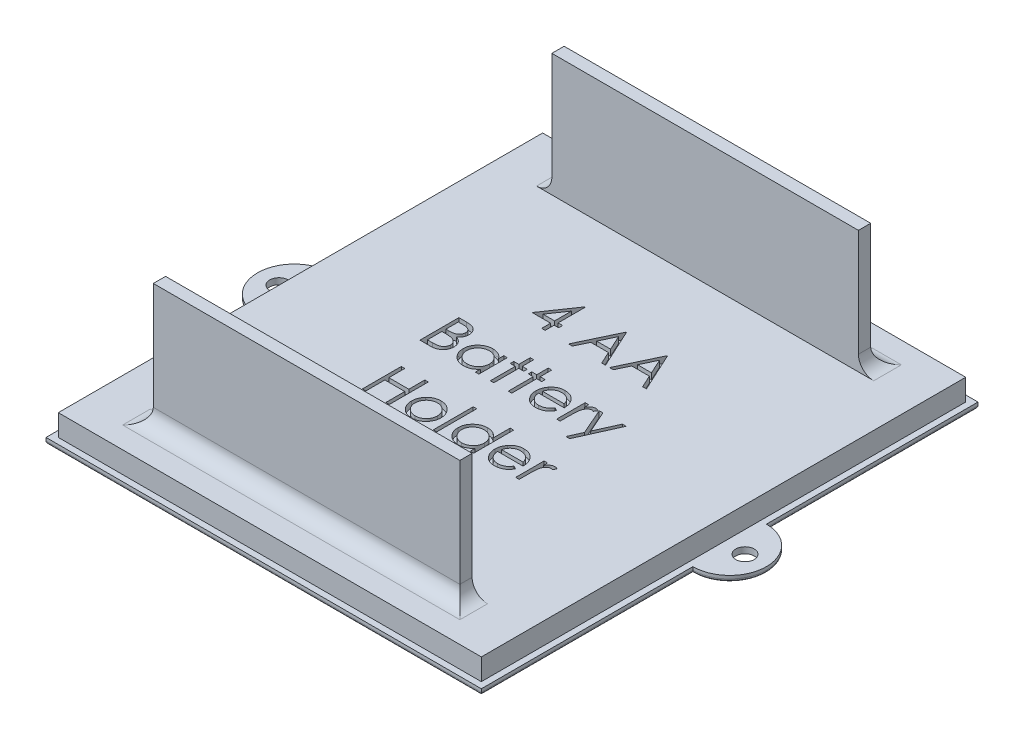
from build123d import *

# Parameters (mm, degrees)
SKETCH1_W            = 71
SKETCH1_H            = 81
BOSS_EXTRUDE1_DEPTH  = 4.5
TEXT_2_W             = 0.569871795
TEXT_2_H             = 6.512820513
CUT_EXTRUDE1_DEPTH   = 1
BOSS_EXTRUDE3_DEPTH  = 4.5
SKETCH5_R            = 1.5
CUT_EXTRUDE2_DEPTH   = 4.5
SKETCH9_W            = 50
SKETCH9_H            = 2
TOP_TRACK_DEPTH      = 20
SKETCH51_W           = 89
SKETCH51_H           = 99
SKETCH51_W_2         = 69
SKETCH51_H_2         = 79
CUT_EXTRUDE25_DEPTH  = 3.5
FILLET2_R            = 0.5
FILLET3_R            = 2.5
FILLET3_OF_MIRROR4_R = 2.5


with BuildPart() as part:
    # Sketch1 → Boss-Extrude1 (new body)
    with BuildSketch(Plane(origin=(0, 0, 0), x_dir=(1, 0, 0), z_dir=(0, 1, 0))):
        Rectangle(SKETCH1_W, SKETCH1_H)
    extrude(amount=BOSS_EXTRUDE1_DEPTH)

    # text 2 → Cut-Extrude1 (cut)
    # profile 1 of 16: a face of its own
    with BuildSketch(Plane(origin=(0, 4.5, 0), x_dir=(1, 0, 0), z_dir=(0, 1, 0))):
        Polygon((-6.532893084, 18.330539216), (-6.417137876, 18.330539216), (-6.417137876, 13.934385369), (-5.684445568, 13.934385369), (-5.684445568, 13.283103318), (-6.417137876, 13.283103318), (-6.417137876, 11.817718703), (-6.987009671, 11.817718703), (-6.987009671, 13.283103318), (-9.999189158, 13.283103318), align=None)
        Polygon((-6.987009671, 13.934385369), (-6.987009671, 16.692157805), (-8.879798132, 13.934385369), align=None, mode=Mode.SUBTRACT)
    # profile 2 of 16: a face of its own
    with BuildSketch(Plane(origin=(0, 4.5, 0), x_dir=(1, 0, 0), z_dir=(0, 1, 0))):
        Polygon((0.502733919, 18.167718703), (3.43350315, 11.817718703), (2.81402198, 11.817718703), (1.875259961, 13.852975113), (-1.003355825, 13.852975113), (-1.968830584, 11.817718703), (-2.590855825, 11.817718703), (0.421323663, 18.167718703), align=None)
        Polygon((0.455668615, 16.930028398), (-0.694251257, 14.504257164), (1.57505964, 14.504257164), align=None, mode=Mode.SUBTRACT)
    # profile 3 of 16: a face of its own
    with BuildSketch(Plane(origin=(0, 4.5, 0), x_dir=(1, 0, 0), z_dir=(0, 1, 0))):
        Polygon((7.178374945, 18.167718703), (10.109144175, 11.817718703), (9.489663006, 11.817718703), (8.550900986, 13.852975113), (5.672285201, 13.852975113), (4.706810441, 11.817718703), (4.084785201, 11.817718703), (7.096964688, 18.167718703), align=None)
        Polygon((7.13130964, 16.930028398), (5.981389768, 14.504257164), (8.250700666, 14.504257164), align=None, mode=Mode.SUBTRACT)
    # profile 4 of 16: a face of its own
    with BuildSketch(Plane(origin=(0, 4.5, 0), x_dir=(1, 0, 0), z_dir=(0, 1, 0))):
        with BuildLine():
            Line((-15.250150696, 6.584385369), (-14.011188357, 6.584385369))
            add(Edge.make_bspline(
                [(-14.011188357, 6.584385369), (-13.950539546, 6.584066508), (-13.832987057, 6.583448475), (-13.66204607, 6.573863366), (-13.501937514, 6.56079385), (-13.352614955, 6.540056397), (-13.214147395, 6.515034172), (-13.086117539, 6.484732306), (-12.968932512, 6.448398307), (-12.829027976, 6.390620054), (-12.669514777, 6.304762306), (-12.496797693, 6.177891909), (-12.349107145, 6.022711583), (-12.221769112, 5.847664479), (-12.120529938, 5.655103865), (-12.047288498, 5.449619337), (-12.00091921, 5.233861319), (-11.99615048, 5.085737268), (-11.99374044, 5.010877757)],
                knots=[0, 0, 0, 0, 1.001505555, 1.941167018, 2.826882275, 3.653841531, 4.429895133, 5.150066043, 5.825578002, 6.45369114, 7.647487171, 8.808567382, 9.977351308, 11.170798116, 12.373658725, 13.556498008, 14.765093433, 16, 16, 16, 16], degree=3))
            add(Edge.make_bspline(
                [(-11.99374044, 5.010877757), (-11.995723851, 4.940750978), (-11.999621439, 4.802945242), (-12.036891874, 4.601388787), (-12.095240516, 4.409525861), (-12.17634861, 4.228056676), (-12.281762232, 4.061081407), (-12.406690896, 3.907253081), (-12.557415952, 3.773084735), (-12.670342973, 3.698076898), (-12.727704783, 3.659976315)],
                knots=[0, 0, 0, 0, 1.044552857, 2.05264487, 3.044412934, 4.028983338, 5.005914585, 5.980388656, 6.974128949, 8, 8, 8, 8], degree=3))
            add(Edge.make_bspline(
                [(-12.727704783, 3.659976315), (-12.655568007, 3.632281245), (-12.517552485, 3.579293717), (-12.327622149, 3.485612232), (-12.16398293, 3.383718118), (-12.025376679, 3.272444618), (-11.906835505, 3.152504347), (-11.803325169, 3.02213864), (-11.715003247, 2.879646893), (-11.639324085, 2.726514765), (-11.580271342, 2.564305887), (-11.536046487, 2.394541764), (-11.510705544, 2.217831143), (-11.507099395, 2.097570526), (-11.505278902, 2.036859328)],
                knots=[0, 0, 0, 0, 1.27268992, 2.434971085, 3.483601985, 4.442670788, 5.356604649, 6.2567628, 7.179492994, 8.113709626, 9.066344395, 10.018646069, 10.999752585, 12, 12, 12, 12], degree=3))
            add(Edge.make_bspline(
                [(-11.505278902, 2.036859328), (-11.507051179, 1.97487086), (-11.510538185, 1.852906812), (-11.536264706, 1.673736782), (-11.579824086, 1.502513665), (-11.639824594, 1.338129976), (-11.718133365, 1.180903732), (-11.8134341, 1.030656811), (-11.927065651, 0.888898811), (-12.054179713, 0.754054523), (-12.197983892, 0.632809823), (-12.353133904, 0.524831327), (-12.521583656, 0.436029186), (-12.700566559, 0.361432975), (-12.89209039, 0.304451344), (-13.095295121, 0.264586817), (-13.310005497, 0.23772625), (-13.457343188, 0.235517892), (-13.5329031, 0.234385369)],
                knots=[0, 0, 0, 0, 0.978564426, 1.925352924, 2.850884081, 3.763762016, 4.682927383, 5.618979971, 6.567305752, 7.547517671, 8.540179244, 9.531824382, 10.526200242, 11.540722885, 12.589160233, 13.674978461, 14.80764778, 16, 16, 16, 16], degree=3))
            Line((-13.5329031, 0.234385369), (-15.250150696, 0.234385369))
            Line((-15.250150696, 0.234385369), (-15.250150696, 6.584385369))
        make_face()
        with BuildLine():
            Line((-14.680278902, 5.933103318), (-14.680278902, 3.897846908))
            Line((-14.680278902, 3.897846908), (-14.297396289, 3.897846908))
            add(Edge.make_bspline(
                [(-14.297396289, 3.897846908), (-14.241427761, 3.898572482), (-14.133285157, 3.89997444), (-13.976676202, 3.903990393), (-13.831306526, 3.915235414), (-13.697427058, 3.926477204), (-13.575248624, 3.944755385), (-13.465041904, 3.966512522), (-13.365077306, 3.989522935), (-13.249798416, 4.028656147), (-13.119037496, 4.086491358), (-12.979640292, 4.176247404), (-12.856750612, 4.283153016), (-12.752978571, 4.406508046), (-12.668049189, 4.542336698), (-12.60906002, 4.688471752), (-12.569059947, 4.841271135), (-12.565446741, 4.946169965), (-12.563612235, 4.99942944)],
                knots=[0, 0, 0, 0, 1.156816544, 2.235205308, 3.236616184, 4.169592532, 5.011045266, 5.787822928, 6.49130361, 7.128639758, 8.301311294, 9.436451833, 10.541879658, 11.654887649, 12.756523258, 13.837046038, 14.901820046, 16, 16, 16, 16], degree=3))
            add(Edge.make_bspline(
                [(-12.563612235, 4.99942944), (-12.564566876, 5.03467334), (-12.566439509, 5.103808098), (-12.581776215, 5.204590497), (-12.6078431, 5.299375591), (-12.641324461, 5.389462334), (-12.68811251, 5.472033834), (-12.743200508, 5.54994506), (-12.809758832, 5.620542761), (-12.885518528, 5.686527422), (-12.972619886, 5.745028208), (-13.071010944, 5.796265022), (-13.182022873, 5.837523288), (-13.303784767, 5.873656879), (-13.438170883, 5.89903564), (-13.583630429, 5.920178215), (-13.741354848, 5.930941904), (-13.850475249, 5.932366777), (-13.906881466, 5.933103318)],
                knots=[0, 0, 0, 0, 0.91205012, 1.789085906, 2.630437955, 3.453916878, 4.269457761, 5.079663411, 5.91843418, 6.774407191, 7.675494373, 8.627863946, 9.638891023, 10.736472738, 11.911756761, 13.175263542, 14.539845004, 16, 16, 16, 16], degree=3))
            Line((-13.906881466, 5.933103318), (-14.680278902, 5.933103318))
        make_face(mode=Mode.SUBTRACT)
        with BuildLine():
            Line((-14.680278902, 3.246564857), (-14.680278902, 0.885667421))
            Line((-14.680278902, 0.885667421), (-13.868720408, 0.885667421))
            add(Edge.make_bspline(
                [(-13.868720408, 0.885667421), (-13.810628928, 0.886363648), (-13.698665259, 0.887705535), (-13.53701017, 0.892086227), (-13.387180825, 0.902050784), (-13.249860921, 0.917736825), (-13.123567671, 0.934752012), (-13.009816124, 0.957632479), (-12.907684188, 0.983847021), (-12.789257944, 1.024367591), (-12.655901579, 1.087316902), (-12.512190454, 1.182229856), (-12.384417172, 1.295302143), (-12.275913345, 1.42616823), (-12.18698978, 1.568465066), (-12.122300597, 1.719314487), (-12.0824029, 1.876223944), (-12.077572964, 1.983206408), (-12.075150696, 2.036859328)],
                knots=[0, 0, 0, 0, 1.160039823, 2.235823828, 3.228722157, 4.157150951, 4.99529583, 5.772374946, 6.472645482, 7.099169577, 8.269452708, 9.405989375, 10.527446681, 11.663510218, 12.788923519, 13.866172445, 14.929861265, 16, 16, 16, 16], degree=3))
            add(Edge.make_bspline(
                [(-12.075150696, 2.036859328), (-12.075651629, 2.070411531), (-12.076645413, 2.136974738), (-12.091632528, 2.234793439), (-12.113429121, 2.329546095), (-12.141607579, 2.421489995), (-12.182645755, 2.508962835), (-12.230554773, 2.593694622), (-12.286727601, 2.675797363), (-12.374256302, 2.779596737), (-12.501568331, 2.899189032), (-12.68246491, 3.0162785), (-12.88815465, 3.110708093), (-13.037338816, 3.150802857), (-13.114403501, 3.171514776)],
                knots=[0, 0, 0, 0, 0.723448775, 1.435228256, 2.130040452, 2.821711965, 3.505591119, 4.210454504, 4.921174351, 5.648778258, 7.137944449, 8.670945889, 10.280296675, 12, 12, 12, 12], degree=3))
            add(Edge.make_bspline(
                [(-13.114403501, 3.171514776), (-13.145299146, 3.177783286), (-13.212287278, 3.191374707), (-13.321521031, 3.205721541), (-13.446227536, 3.218503292), (-13.586694756, 3.227957821), (-13.743100411, 3.23773055), (-13.915778535, 3.241531154), (-14.104023948, 3.246065526), (-14.234638681, 3.246394155), (-14.30248443, 3.246564857)],
                knots=[0, 0, 0, 0, 0.634451884, 1.375622551, 2.216452059, 3.157844607, 4.20941857, 5.370758133, 6.634282058, 8, 8, 8, 8], degree=3))
            Line((-14.30248443, 3.246564857), (-14.680278902, 3.246564857))
        make_face(mode=Mode.SUBTRACT)
    # profile 5 of 16: a face of its own
    with BuildSketch(Plane(origin=(0, 4.5, 0), x_dir=(1, 0, 0), z_dir=(0, 1, 0))):
        with BuildLine():
            Line((-5.64374044, 4.874769985), (-5.64374044, 0.234385369))
            Line((-5.64374044, 0.234385369), (-6.213612235, 0.234385369))
            Line((-6.213612235, 0.234385369), (-6.213612235, 1.037039616))
            add(Edge.make_bspline(
                [(-6.213612235, 1.037039616), (-6.277872041, 0.964396353), (-6.40327586, 0.822632111), (-6.612719031, 0.637425884), (-6.834729868, 0.4843395), (-7.068230836, 0.360696082), (-7.313011078, 0.267819065), (-7.568527979, 0.201804177), (-7.83488577, 0.159361076), (-8.016772185, 0.155122865), (-8.108944767, 0.152975113)],
                knots=[0, 0, 0, 0, 1.074387032, 2.096679803, 3.090159297, 4.057316773, 5.018401886, 5.985159533, 6.978961417, 8, 8, 8, 8], degree=3))
            add(Edge.make_bspline(
                [(-8.108944767, 0.152975113), (-8.19089234, 0.155200103), (-8.352496583, 0.159587881), (-8.590220766, 0.19362806), (-8.818988133, 0.248293617), (-9.039014858, 0.324313802), (-9.248877179, 0.425153293), (-9.450371926, 0.545878128), (-9.642455238, 0.689643634), (-9.822199316, 0.8539962), (-9.987720231, 1.03251282), (-10.132974254, 1.222914026), (-10.254083413, 1.424376492), (-10.355356988, 1.6343495), (-10.433364642, 1.854449425), (-10.487745378, 2.083915144), (-10.521745903, 2.322475343), (-10.526131867, 2.484925621), (-10.528355825, 2.56729803)],
                knots=[0, 0, 0, 0, 1.033919861, 2.038935746, 3.024066025, 3.998881131, 4.97069526, 5.957263378, 6.95902576, 7.993208707, 9.027059324, 10.027763471, 11.009749337, 11.988697705, 12.965288445, 13.950418724, 14.960734635, 16, 16, 16, 16], degree=3))
            add(Edge.make_bspline(
                [(-10.528355825, 2.56729803), (-10.526082577, 2.647967892), (-10.521588488, 2.807447858), (-10.488109075, 3.041996352), (-10.431809959, 3.267908054), (-10.352801721, 3.484455651), (-10.25148846, 3.691901171), (-10.128247502, 3.89039133), (-9.983069947, 4.080472951), (-9.815697723, 4.257676463), (-9.634387497, 4.421362435), (-9.440424514, 4.563618846), (-9.238633703, 4.686476557), (-9.025885099, 4.783819293), (-8.805327637, 4.862575811), (-8.574997814, 4.917064196), (-8.33585395, 4.949172193), (-8.173492629, 4.953821779), (-8.091136273, 4.956180241)],
                knots=[0, 0, 0, 0, 1.020392517, 2.01726096, 2.990465484, 3.961182959, 4.928053699, 5.906110375, 6.912531644, 7.948652711, 8.985773172, 9.998621852, 10.987621588, 11.969261332, 12.953316658, 13.946091881, 14.958173133, 16, 16, 16, 16], degree=3))
            add(Edge.make_bspline(
                [(-8.091136273, 4.956180241), (-7.996430815, 4.953571749), (-7.81071788, 4.948456619), (-7.539068492, 4.905888528), (-7.282084939, 4.833973024), (-7.037783472, 4.736151277), (-6.80704137, 4.606160012), (-6.592043098, 4.442184939), (-6.390538579, 4.245260214), (-6.273734335, 4.094002408), (-6.213612235, 4.016146187)],
                knots=[0, 0, 0, 0, 1.038897134, 2.037228247, 3.008116434, 3.962042015, 4.918381754, 5.904844433, 6.921570401, 8, 8, 8, 8], degree=3))
            Line((-6.213612235, 4.016146187), (-6.213612235, 4.874769985))
            Line((-6.213612235, 4.874769985), (-5.64374044, 4.874769985))
        make_face()
        with BuildLine():
            add(Edge.make_bspline(
                [(-8.083504062, 4.386308446), (-8.166805789, 4.383344561), (-8.331230149, 4.377494322), (-8.572609981, 4.331822409), (-8.80359289, 4.255831788), (-9.023023624, 4.151906053), (-9.22743596, 4.021225345), (-9.410123049, 3.863162264), (-9.572579093, 3.682029396), (-9.709209801, 3.478644138), (-9.820589702, 3.260606744), (-9.898907032, 3.032688121), (-9.950558381, 2.79899909), (-9.955835268, 2.640498217), (-9.95848403, 2.560937853)],
                knots=[0, 0, 0, 0, 1.031046209, 2.035121221, 3.029706178, 4.034933723, 5.034054252, 6.02443088, 7.017295772, 8.038157696, 9.050218397, 10.03989886, 11.016116709, 12, 12, 12, 12], degree=3))
            add(Edge.make_bspline(
                [(-9.95848403, 2.560937853), (-9.95510058, 2.481852945), (-9.948346944, 2.323993113), (-9.899813541, 2.089985495), (-9.818388628, 1.862013162), (-9.707278028, 1.642011074), (-9.568146581, 1.437751349), (-9.406877168, 1.253165698), (-9.221910229, 1.094434588), (-9.017027466, 0.961560704), (-8.798210149, 0.854222988), (-8.568097159, 0.779536756), (-8.331014215, 0.731317068), (-8.169810695, 0.72568466), (-8.088592203, 0.722846908)],
                knots=[0, 0, 0, 0, 0.979072187, 1.954306742, 2.945804271, 3.96968567, 4.997920485, 5.998718438, 6.996577872, 8.005894225, 9.015743152, 10.005417472, 10.995077863, 12, 12, 12, 12], degree=3))
            add(Edge.make_bspline(
                [(-8.088592203, 0.722846908), (-8.006139262, 0.725858557), (-7.842148541, 0.731848428), (-7.600052599, 0.777715866), (-7.365111738, 0.8534964), (-7.140526338, 0.958541959), (-6.931309929, 1.088730304), (-6.743535208, 1.241143169), (-6.584756237, 1.418404661), (-6.450149645, 1.613216225), (-6.344602818, 1.826779419), (-6.267720539, 2.054171451), (-6.222265596, 2.295400237), (-6.216536572, 2.460253361), (-6.213612235, 2.544401395)],
                knots=[0, 0, 0, 0, 1.01762866, 2.023962475, 3.030623092, 4.058876274, 5.077231937, 6.066672613, 7.034107872, 8.005628644, 8.981990164, 9.965428785, 10.961468474, 12, 12, 12, 12], degree=3))
            add(Edge.make_bspline(
                [(-6.213612235, 2.544401395), (-6.215353326, 2.608514316), (-6.218780343, 2.734708834), (-6.24496152, 2.91999733), (-6.286608315, 3.097314233), (-6.345293509, 3.266845969), (-6.422384839, 3.427655211), (-6.515362929, 3.580896604), (-6.625862816, 3.725773145), (-6.752105708, 3.86028986), (-6.890291146, 3.982983584), (-7.03651267, 4.092501564), (-7.192502683, 4.182469766), (-7.355637878, 4.256930358), (-7.526201299, 4.316183387), (-7.705580852, 4.355712489), (-7.891869871, 4.382854786), (-8.018953429, 4.385145105), (-8.083504062, 4.386308446)],
                knots=[0, 0, 0, 0, 1.050140795, 2.067009409, 3.05949893, 4.030605086, 5.00011959, 5.97591094, 6.962425594, 7.979863591, 8.993523472, 9.986985069, 10.967611495, 11.937549037, 12.921786183, 13.919465291, 14.943216303, 16, 16, 16, 16], degree=3))
        make_face(mode=Mode.SUBTRACT)
    # profile 6 of 16: a face of its own
    with BuildSketch(Plane(origin=(0, 4.5, 0), x_dir=(1, 0, 0), z_dir=(0, 1, 0))):
        Polygon((-3.771304543, 6.747205882), (-3.201432748, 6.747205882), (-3.201432748, 4.874769985), (-2.387330184, 4.874769985), (-2.387330184, 4.30489819), (-3.201432748, 4.30489819), (-3.201432748, 0.234385369), (-3.771304543, 0.234385369), (-3.771304543, 4.30489819), (-4.585407107, 4.30489819), (-4.585407107, 4.874769985), (-3.771304543, 4.874769985), align=None)
    # profile 7 of 16: a face of its own
    with BuildSketch(Plane(origin=(0, 4.5, 0), x_dir=(1, 0, 0), z_dir=(0, 1, 0))):
        Polygon((-0.840535312, 6.747205882), (-0.270663517, 6.747205882), (-0.270663517, 4.874769985), (0.543439047, 4.874769985), (0.543439047, 4.30489819), (-0.270663517, 4.30489819), (-0.270663517, 0.234385369), (-0.840535312, 0.234385369), (-0.840535312, 4.30489819), (-1.654637876, 4.30489819), (-1.654637876, 4.874769985), (-0.840535312, 4.874769985), align=None)
    # profile 8 of 16: a face of its own
    with BuildSketch(Plane(origin=(0, 4.5, 0), x_dir=(1, 0, 0), z_dir=(0, 1, 0))):
        with BuildLine():
            Line((5.328835682, 1.699769985), (5.835105714, 1.433914616))
            add(Edge.make_bspline(
                [(5.835105714, 1.433914616), (5.794762177, 1.362353144), (5.71626963, 1.223122857), (5.581285416, 1.031839339), (5.439785513, 0.859758483), (5.285382599, 0.711477539), (5.122696182, 0.582207169), (4.95082408, 0.469108544), (4.76887151, 0.372736371), (4.576829867, 0.291542499), (4.373086395, 0.229113846), (4.157147359, 0.185019045), (3.928599074, 0.157762543), (3.771942433, 0.154596359), (3.691726307, 0.152975113)],
                knots=[0, 0, 0, 0, 1.120438281, 2.179929193, 3.190490725, 4.156257408, 5.095198341, 6.022838206, 6.959905092, 7.901321166, 8.864066838, 9.862729781, 10.905609505, 12, 12, 12, 12], degree=3))
            add(Edge.make_bspline(
                [(3.691726307, 0.152975113), (3.602568719, 0.155056417), (3.428648094, 0.159116438), (3.175483125, 0.19411848), (2.937123323, 0.251218331), (2.713582089, 0.330984385), (2.50540686, 0.435173959), (2.31218388, 0.562100447), (2.132897026, 0.711111823), (1.973195961, 0.883498799), (1.829424917, 1.067978922), (1.7025595, 1.260213169), (1.596501018, 1.459717877), (1.510226997, 1.66522297), (1.440549599, 1.875433177), (1.391987151, 2.092261125), (1.363993179, 2.315119971), (1.3597034, 2.46588228), (1.357541611, 2.541857325)],
                knots=[0, 0, 0, 0, 1.145258523, 2.234067595, 3.276747158, 4.290159414, 5.277019952, 6.260822364, 7.254936242, 8.264827045, 9.274100331, 10.257902744, 11.220704747, 12.172965371, 13.118907548, 14.062713208, 15.023725156, 16, 16, 16, 16], degree=3))
            add(Edge.make_bspline(
                [(1.357541611, 2.541857325), (1.359463196, 2.613149374), (1.363271524, 2.754440801), (1.387275953, 2.963565432), (1.429817856, 3.166817053), (1.488194901, 3.364364552), (1.563580733, 3.555877166), (1.655804902, 3.741471453), (1.765011073, 3.920949921), (1.849325781, 4.034167035), (1.891796419, 4.091196267)],
                knots=[0, 0, 0, 0, 1.024358464, 2.0301432, 3.019427413, 4.004406732, 4.986367066, 5.972626655, 6.978780325, 8, 8, 8, 8], degree=3))
            add(Edge.make_bspline(
                [(1.891796419, 4.091196267), (1.949323215, 4.159901217), (2.062554504, 4.295134718), (2.254063891, 4.472822824), (2.461437105, 4.621673673), (2.682075341, 4.745058049), (2.918542944, 4.838808808), (3.167661229, 4.908672564), (3.432266792, 4.947821242), (3.61316055, 4.953350883), (3.705718695, 4.956180241)],
                knots=[0, 0, 0, 0, 1.030682036, 2.02871468, 2.997146059, 3.962720338, 4.930598197, 5.918074684, 6.934738563, 8, 8, 8, 8], degree=3))
            add(Edge.make_bspline(
                [(3.705718695, 4.956180241), (3.800873636, 4.95372361), (3.987545939, 4.948904259), (4.259747073, 4.904225054), (4.517304373, 4.833372562), (4.760114774, 4.733307828), (4.988202892, 4.604204069), (5.200086154, 4.444289585), (5.399388184, 4.258473913), (5.515336605, 4.115574947), (5.574338486, 4.042858927)],
                knots=[0, 0, 0, 0, 1.056321875, 2.072262726, 3.055038591, 4.01806755, 4.982017516, 5.957941055, 6.960871419, 8, 8, 8, 8], degree=3))
            add(Edge.make_bspline(
                [(5.574338486, 4.042858927), (5.614483074, 3.988061001), (5.694505036, 3.8788299), (5.79473906, 3.700719372), (5.881747477, 3.514373008), (5.951294421, 3.316778612), (6.007608944, 3.110277373), (6.04835203, 2.893393042), (6.072245481, 2.666190203), (6.076942117, 2.511383452), (6.079336483, 2.432462292)],
                knots=[0, 0, 0, 0, 0.94817472, 1.890038105, 2.849395472, 3.817997239, 4.812318967, 5.836947057, 6.897266129, 8, 8, 8, 8], degree=3))
            Line((6.079336483, 2.432462292), (1.927413406, 2.432462292))
            add(Edge.make_bspline(
                [(1.927413406, 2.432462292), (1.930206692, 2.371320022), (1.935699576, 2.251086212), (1.961308479, 2.075153506), (2.001674111, 1.90756187), (2.058405125, 1.749568351), (2.127106401, 1.599109406), (2.211263345, 1.457301139), (2.311665107, 1.324789466), (2.423653161, 1.200389087), (2.548307463, 1.089607421), (2.679449019, 0.990453484), (2.818955915, 0.907349044), (2.965728152, 0.839894101), (3.119528391, 0.787086928), (3.280405088, 0.751041025), (3.44804167, 0.726898131), (3.562315788, 0.724213595), (3.620492332, 0.722846908)],
                knots=[0, 0, 0, 0, 1.094153842, 2.151609401, 3.174256925, 4.172055639, 5.149267565, 6.128595816, 7.11444997, 8.118368179, 9.117203808, 10.09244225, 11.054858984, 12.015122123, 12.976791628, 13.957293641, 14.960065497, 16, 16, 16, 16], degree=3))
            add(Edge.make_bspline(
                [(3.620492332, 0.722846908), (3.677372272, 0.723950096), (3.790232982, 0.726139034), (3.958309966, 0.747424072), (4.123663109, 0.781841572), (4.285608036, 0.828813412), (4.440857999, 0.886102843), (4.584632068, 0.955232314), (4.716857603, 1.031703997), (4.840441242, 1.119170122), (4.960312901, 1.226227832), (5.079225698, 1.359824069), (5.206727626, 1.517825727), (5.286537316, 1.636744292), (5.328835682, 1.699769985)],
                knots=[0, 0, 0, 0, 0.99110716, 1.966546729, 2.947904876, 3.932708344, 4.903319531, 5.828989031, 6.710028674, 7.56322171, 8.463672341, 9.504779593, 10.677557249, 12, 12, 12, 12], degree=3))
        make_face()
        with BuildLine():
            add(Edge.make_bspline(
                [(5.509464688, 3.002334087), (5.488606527, 3.077922444), (5.44846128, 3.223405698), (5.364575304, 3.4248656), (5.270102652, 3.603913649), (5.158303225, 3.759179554), (5.031632108, 3.897071642), (4.885318705, 4.017573932), (4.721242156, 4.125374165), (4.540250572, 4.216365128), (4.348586191, 4.293816729), (4.147914957, 4.345750868), (3.943158684, 4.38132818), (3.804666479, 4.384641263), (3.734975506, 4.386308446)],
                knots=[0, 0, 0, 0, 1.154881502, 2.222775134, 3.210006277, 4.132804581, 5.035138423, 5.962687519, 6.919655026, 7.923214229, 8.944639381, 9.960483929, 10.97369054, 12, 12, 12, 12], degree=3))
            add(Edge.make_bspline(
                [(3.734975506, 4.386308446), (3.678098667, 4.385198699), (3.565665115, 4.383004963), (3.400018892, 4.362194871), (3.240942866, 4.327796295), (3.087263273, 4.280688446), (2.940993983, 4.217898553), (2.799126332, 4.144268984), (2.665267614, 4.054386397), (2.58155412, 3.985881046), (2.539262365, 3.951272389)],
                knots=[0, 0, 0, 0, 1.04873581, 2.073130211, 3.073294108, 4.04793562, 5.032784715, 6.005352987, 6.992311501, 8, 8, 8, 8], degree=3))
            add(Edge.make_bspline(
                [(2.539262365, 3.951272389), (2.508975982, 3.923886987), (2.447683724, 3.86846561), (2.36578592, 3.772981192), (2.287371634, 3.670017644), (2.21600915, 3.555635775), (2.1505541, 3.431138076), (2.089303856, 3.297574652), (2.034174223, 3.153931973), (2.003156994, 3.053833404), (1.987199063, 3.002334087)],
                knots=[0, 0, 0, 0, 0.879870761, 1.780643979, 2.707998968, 3.669668524, 4.684282772, 5.740141944, 6.837334558, 8, 8, 8, 8], degree=3))
            Line((1.987199063, 3.002334087), (5.509464688, 3.002334087))
        make_face(mode=Mode.SUBTRACT)
    # profile 9 of 16: a face of its own
    with BuildSketch(Plane(origin=(0, 4.5, 0), x_dir=(1, 0, 0), z_dir=(0, 1, 0))):
        with BuildLine():
            Line((7.05625956, 4.874769985), (7.626131355, 4.874769985))
            Line((7.626131355, 4.874769985), (7.626131355, 4.191687052))
            add(Edge.make_bspline(
                [(7.626131355, 4.191687052), (7.668202389, 4.255288341), (7.748662914, 4.376925311), (7.882399228, 4.537796757), (8.019383844, 4.670992627), (8.160272541, 4.777134725), (8.306101379, 4.856624241), (8.453669849, 4.914850176), (8.60529963, 4.949280448), (8.707193407, 4.953877229), (8.758242733, 4.956180241)],
                knots=[0, 0, 0, 0, 1.2804753, 2.448899062, 3.506932113, 4.484331642, 5.4025378, 6.288909075, 7.142734305, 8, 8, 8, 8], degree=3))
            add(Edge.make_bspline(
                [(8.758242733, 4.956180241), (8.797841925, 4.954020286), (8.879319837, 4.949576037), (9.002659679, 4.918350684), (9.129738513, 4.8684977), (9.211639701, 4.821616153), (9.254336483, 4.797175834)],
                knots=[0, 0, 0, 0, 0.901110191, 1.854092781, 2.881294221, 4, 4, 4, 4], degree=3))
            Line((9.254336483, 4.797175834), (8.94141581, 4.303626155))
            add(Edge.make_bspline(
                [(8.94141581, 4.303626155), (8.914003729, 4.315854923), (8.861970351, 4.339067467), (8.785852781, 4.3665394), (8.715673784, 4.382715418), (8.670963328, 4.385166006), (8.650119736, 4.386308446)],
                knots=[0, 0, 0, 0, 1.180555205, 2.24091978, 3.179933427, 4, 4, 4, 4], degree=3))
            add(Edge.make_bspline(
                [(8.650119736, 4.386308446), (8.604389334, 4.383260379), (8.511112569, 4.377043204), (8.37416212, 4.32816851), (8.241270762, 4.249201288), (8.135730746, 4.1616237), (8.05401123, 4.077172696), (7.995699678, 4.00342488), (7.942209551, 3.92073222), (7.891100723, 3.830508365), (7.844534732, 3.731212787), (7.801074118, 3.623837528), (7.761778752, 3.508258223), (7.739371881, 3.427735651), (7.727894175, 3.386488735)],
                knots=[0, 0, 0, 0, 1.125678352, 2.296057538, 3.5422874, 4.923748041, 5.663163013, 6.437101912, 7.23742474, 8.08941207, 8.991984279, 9.93940061, 10.944477711, 12, 12, 12, 12], degree=3))
            add(Edge.make_bspline(
                [(7.727894175, 3.386488735), (7.719308262, 3.349700148), (7.700291115, 3.268216225), (7.681800754, 3.131512473), (7.663531771, 2.969998121), (7.650656478, 2.783223588), (7.63872203, 2.571655297), (7.631990881, 2.334970938), (7.626360897, 2.072927573), (7.62621019, 1.889731246), (7.626131355, 1.793900594)],
                knots=[0, 0, 0, 0, 0.566838948, 1.255505196, 2.06880316, 3.007127437, 4.065329342, 5.249902469, 6.561414163, 8, 8, 8, 8], degree=3))
            Line((7.626131355, 1.793900594), (7.626131355, 0.234385369))
            Line((7.626131355, 0.234385369), (7.05625956, 0.234385369))
            Line((7.05625956, 0.234385369), (7.05625956, 4.874769985))
        make_face()
    # profile 10 of 16: a face of its own
    with BuildSketch(Plane(origin=(0, 4.5, 0), x_dir=(1, 0, 0), z_dir=(0, 1, 0))):
        Polygon((9.33574674, 4.874769985), (9.950139768, 4.874769985), (11.52110331, 1.320703478), (13.116235522, 4.874769985), (13.731900586, 4.874769985), (10.882541611, -1.475230015), (10.266876547, -1.475230015), (11.211998743, 0.629988334), align=None)
    # profile 11 of 16: a face of its own
    with BuildSketch(Plane(origin=(0, 4.5, 0), x_dir=(1, 0, 0), z_dir=(0, 1, 0))):
        Polygon((-13.052073773, -4.998947964), (-12.482201978, -4.998947964), (-12.482201978, -7.604076169), (-9.225791722, -7.604076169), (-9.225791722, -4.998947964), (-8.655919927, -4.998947964), (-8.655919927, -11.348947964), (-9.225791722, -11.348947964), (-9.225791722, -8.25535822), (-12.482201978, -8.25535822), (-12.482201978, -11.348947964), (-13.052073773, -11.348947964), align=None)
    # profile 12 of 16: a face of its own
    with BuildSketch(Plane(origin=(0, 4.5, 0), x_dir=(1, 0, 0), z_dir=(0, 1, 0))):
        with BuildLine():
            add(Edge.make_bspline(
                [(-4.94920919, -6.627153092), (-4.862139309, -6.629007095), (-4.691416552, -6.63264234), (-4.441393673, -6.671495207), (-4.202733212, -6.730908282), (-3.974521121, -6.81304383), (-3.759680128, -6.923138226), (-3.555080871, -7.054509369), (-3.361284297, -7.210143503), (-3.24512823, -7.330535998), (-3.186168325, -7.391646281)],
                knots=[0, 0, 0, 0, 1.054011418, 2.066658804, 3.057071809, 4.030435133, 4.997543892, 5.974964718, 6.972108034, 8, 8, 8, 8], degree=3))
            add(Edge.make_bspline(
                [(-3.186168325, -7.391646281), (-3.135401065, -7.450091655), (-3.034849032, -7.565851325), (-2.905915514, -7.753549366), (-2.794842112, -7.94793212), (-2.705827883, -8.151580841), (-2.635642197, -8.362717744), (-2.585811577, -8.582068536), (-2.556171709, -8.809148794), (-2.552174897, -8.963370043), (-2.550150696, -9.041476009)],
                knots=[0, 0, 0, 0, 1.025258237, 2.030674902, 3.01204498, 3.988269485, 4.97094183, 5.956517959, 6.965070386, 8, 8, 8, 8], degree=3))
            add(Edge.make_bspline(
                [(-2.550150696, -9.041476009), (-2.551931123, -9.120034685), (-2.555449328, -9.275270292), (-2.588729889, -9.503905428), (-2.640493431, -9.725601749), (-2.714574051, -9.939431093), (-2.809566621, -10.14604708), (-2.925482583, -10.344547262), (-3.063135374, -10.535323275), (-3.219171197, -10.716755182), (-3.391622458, -10.883971029), (-3.578704612, -11.029709461), (-3.776741216, -11.154571369), (-3.988365586, -11.255148866), (-4.211645169, -11.334450751), (-4.447061564, -11.390149352), (-4.694249049, -11.42382555), (-4.863027008, -11.428150033), (-4.94920919, -11.43035822)],
                knots=[0, 0, 0, 0, 0.998656419, 1.973391657, 2.932242238, 3.890759089, 4.846373663, 5.82037756, 6.809684879, 7.83454468, 8.860553229, 9.859544525, 10.845671541, 11.83227036, 12.833544569, 13.85385346, 14.904124723, 16, 16, 16, 16], degree=3))
            add(Edge.make_bspline(
                [(-4.94920919, -11.43035822), (-5.03581361, -11.428142621), (-5.205432741, -11.423803259), (-5.453492737, -11.390280189), (-5.689331045, -11.334476421), (-5.912902931, -11.254888255), (-6.125437154, -11.154568155), (-6.324621227, -11.030086946), (-6.511855359, -10.883927808), (-6.684343102, -10.716766893), (-6.840369143, -10.535320258), (-6.978024458, -10.344548045), (-7.093939764, -10.146046876), (-7.188932506, -9.939431148), (-7.263013081, -9.725601734), (-7.314776634, -9.503905432), (-7.348057192, -9.275270291), (-7.351575398, -9.120034685), (-7.353355825, -9.041476009)],
                knots=[0, 0, 0, 0, 1.099876186, 2.154163076, 3.173186993, 4.173200201, 5.163417411, 6.152872554, 7.150605724, 8.17532212, 9.198891216, 10.186952605, 11.159729845, 12.11414092, 13.071450619, 14.029093627, 15.002601286, 16, 16, 16, 16], degree=3))
            add(Edge.make_bspline(
                [(-7.353355825, -9.041476009), (-7.351317819, -8.963794561), (-7.347282917, -8.809998645), (-7.317672851, -8.583345264), (-7.268036613, -8.364365715), (-7.197766793, -8.15404378), (-7.10793209, -7.951287489), (-6.998419467, -7.756424439), (-6.868170748, -7.569575144), (-6.768018636, -7.453965084), (-6.717338196, -7.395462387)],
                knots=[0, 0, 0, 0, 1.031353054, 2.041901799, 3.029428768, 4.008703097, 4.981709435, 5.96992636, 6.972712378, 8, 8, 8, 8], degree=3))
            add(Edge.make_bspline(
                [(-6.717338196, -7.395462387), (-6.658467181, -7.33382214), (-6.542686971, -7.212595748), (-6.347925708, -7.057415312), (-6.143829775, -6.923310435), (-5.926614552, -6.815403587), (-5.698589939, -6.730425133), (-5.458706456, -6.671341984), (-5.207835163, -6.632782326), (-5.036276994, -6.629048204), (-4.94920919, -6.627153092)],
                knots=[0, 0, 0, 0, 1.027980169, 2.021703884, 2.998553061, 3.971491411, 4.943284454, 5.930300938, 6.949603206, 8, 8, 8, 8], degree=3))
        make_face()
        with BuildLine():
            add(Edge.make_bspline(
                [(-4.95175326, -7.197024887), (-5.013325784, -7.198774932), (-5.134881346, -7.202229845), (-5.31380545, -7.228507786), (-5.486054015, -7.270141115), (-5.651953832, -7.329294188), (-5.810945445, -7.405673619), (-5.963181075, -7.499487358), (-6.109108501, -7.609492865), (-6.245873102, -7.735517998), (-6.371389583, -7.873184174), (-6.481113912, -8.019866196), (-6.574413747, -8.173184853), (-6.652138036, -8.333299579), (-6.710026791, -8.501832959), (-6.752069275, -8.676876389), (-6.778322426, -8.858786502), (-6.781744855, -8.982450064), (-6.78348403, -9.045292115)],
                knots=[0, 0, 0, 0, 1.021534396, 2.016698045, 2.994645724, 3.958388632, 4.93408049, 5.916473867, 6.921342795, 7.962252576, 8.998418191, 10.008913653, 10.997312074, 11.973003931, 12.956656626, 13.948281152, 14.957379055, 16, 16, 16, 16], degree=3))
            add(Edge.make_bspline(
                [(-6.78348403, -9.045292115), (-6.780568793, -9.126485078), (-6.774782592, -9.287637928), (-6.727728663, -9.524966679), (-6.649013555, -9.752808039), (-6.542719491, -9.96982634), (-6.409539637, -10.170617473), (-6.252627387, -10.349635737), (-6.073666788, -10.504187138), (-5.874791138, -10.632422387), (-5.660062589, -10.734312229), (-5.432811835, -10.806518942), (-5.19579229, -10.853457584), (-5.033811535, -10.858122973), (-4.95175326, -10.860486425)],
                knots=[0, 0, 0, 0, 1.016792936, 2.018143844, 3.017858371, 4.030088057, 5.03801393, 6.028138512, 7.003788237, 7.991172063, 8.984598303, 9.972568034, 10.972917682, 12, 12, 12, 12], degree=3))
            add(Edge.make_bspline(
                [(-4.95175326, -10.860486425), (-4.869699705, -10.858109203), (-4.707728267, -10.853416631), (-4.471038046, -10.806755344), (-4.244408412, -10.733995845), (-4.029902894, -10.632536979), (-3.831117771, -10.503700169), (-3.650870079, -10.350508456), (-3.495297599, -10.170143326), (-3.362249487, -9.969560381), (-3.254214683, -9.753144485), (-3.175868017, -9.524924628), (-3.128700968, -9.287648638), (-3.122930036, -9.126488666), (-3.120022491, -9.045292115)],
                knots=[0, 0, 0, 0, 1.02726834, 2.027799167, 3.010890988, 4.004497153, 4.992059811, 5.971914811, 6.958719428, 7.966827853, 8.981595046, 9.981490638, 10.983022906, 12, 12, 12, 12], degree=3))
            add(Edge.make_bspline(
                [(-3.120022491, -9.045292115), (-3.121761067, -8.982449688), (-3.125182318, -8.858785388), (-3.151444039, -8.67688065), (-3.193454804, -8.501817325), (-3.251460453, -8.333357262), (-3.328847021, -8.17277029), (-3.423946059, -8.020316356), (-3.533222348, -7.872676051), (-3.660253411, -7.735963017), (-3.796875253, -7.609443737), (-3.942861823, -7.499444702), (-4.094871712, -7.406085921), (-4.253401427, -7.328640885), (-4.419322514, -7.270679282), (-4.591329734, -7.228267393), (-4.769490432, -7.202340894), (-4.89061041, -7.198808223), (-4.95175326, -7.197024887)],
                knots=[0, 0, 0, 0, 1.042956736, 2.052379634, 3.044323526, 4.02829302, 5.004299113, 5.996692471, 7.007513377, 8.048758398, 9.090003419, 10.095195979, 11.07790575, 12.047570684, 13.018257071, 13.989683339, 14.985167495, 16, 16, 16, 16], degree=3))
        make_face(mode=Mode.SUBTRACT)
    # profile 13 of 16: a face of its own
    with BuildSketch(Plane(origin=(0, 4.5, 0), x_dir=(1, 0, 0), z_dir=(0, 1, 0))):
        with Locations((-1.206881465, -8.092537708)):
            Rectangle(TEXT_2_W, TEXT_2_H)
    # profile 14 of 16: a face of its own
    with BuildSketch(Plane(origin=(0, 4.5, 0), x_dir=(1, 0, 0), z_dir=(0, 1, 0))):
        with BuildLine():
            Line((5.102413406, -4.836127451), (5.102413406, -11.348947964))
            Line((5.102413406, -11.348947964), (4.532541611, -11.348947964))
            Line((4.532541611, -11.348947964), (4.532541611, -10.546293717))
            add(Edge.make_bspline(
                [(4.532541611, -10.546293717), (4.468281805, -10.61893698), (4.342877986, -10.760701222), (4.133434815, -10.94590745), (3.911423978, -11.098993833), (3.67792301, -11.222637251), (3.433142768, -11.315514268), (3.177625867, -11.381529157), (2.911268076, -11.423972258), (2.729381661, -11.428210469), (2.637209079, -11.43035822)],
                knots=[0, 0, 0, 0, 1.074387032, 2.096679803, 3.090159297, 4.057316773, 5.018401886, 5.985159533, 6.978961417, 8, 8, 8, 8], degree=3))
            add(Edge.make_bspline(
                [(2.637209079, -11.43035822), (2.555261506, -11.428133231), (2.393657263, -11.423745452), (2.15593308, -11.389705273), (1.927165713, -11.335039717), (1.707138988, -11.259019531), (1.497276667, -11.158180041), (1.295781921, -11.037455205), (1.103698608, -10.893689699), (0.92395453, -10.729337133), (0.758433615, -10.550820514), (0.613179592, -10.360419307), (0.492070433, -10.158956842), (0.390796858, -9.948983834), (0.312789204, -9.728883908), (0.258408468, -9.499418189), (0.224407943, -9.26085799), (0.220021979, -9.098407713), (0.217798022, -9.016035304)],
                knots=[0, 0, 0, 0, 1.033919861, 2.038935746, 3.024066025, 3.998881131, 4.97069526, 5.957263378, 6.95902576, 7.993208707, 9.027059324, 10.027763471, 11.009749337, 11.988697705, 12.965288445, 13.950418724, 14.960734635, 16, 16, 16, 16], degree=3))
            add(Edge.make_bspline(
                [(0.217798022, -9.016035304), (0.22007127, -8.935365441), (0.224565358, -8.775885476), (0.258044772, -8.541336981), (0.314343887, -8.315425279), (0.393352125, -8.098877682), (0.494665386, -7.891432163), (0.617906344, -7.692942003), (0.763083899, -7.502860382), (0.930456123, -7.32565687), (1.111766349, -7.161970899), (1.305729332, -7.019714488), (1.507520143, -6.896856776), (1.720268748, -6.799514041), (1.940826209, -6.720757523), (2.171156032, -6.666269138), (2.410299896, -6.63416114), (2.572661218, -6.629511554), (2.655017573, -6.627153092)],
                knots=[0, 0, 0, 0, 1.020392517, 2.01726096, 2.990465484, 3.961182959, 4.928053699, 5.906110375, 6.912531644, 7.948652711, 8.985773172, 9.998621852, 10.987621588, 11.969261332, 12.953316658, 13.946091881, 14.958173133, 16, 16, 16, 16], degree=3))
            add(Edge.make_bspline(
                [(2.655017573, -6.627153092), (2.749753781, -6.629996252), (2.93571043, -6.635577059), (3.207669176, -6.682215754), (3.464912412, -6.760525546), (3.708921118, -6.867734014), (3.938240592, -7.00707252), (4.154551783, -7.175350146), (4.354092954, -7.377329397), (4.472151832, -7.52902468), (4.532541611, -7.60662024)],
                knots=[0, 0, 0, 0, 1.031072012, 2.023879775, 2.993683497, 3.952812103, 4.918022106, 5.908088563, 6.929940113, 8, 8, 8, 8], degree=3))
            Line((4.532541611, -7.60662024), (4.532541611, -4.836127451))
            Line((4.532541611, -4.836127451), (5.102413406, -4.836127451))
        make_face()
        with BuildLine():
            add(Edge.make_bspline(
                [(2.662649784, -7.197024887), (2.579348057, -7.199988773), (2.414923697, -7.205839011), (2.173543865, -7.251510924), (1.942560956, -7.327501545), (1.723130222, -7.43142728), (1.518717886, -7.562107988), (1.336030797, -7.720171069), (1.173574753, -7.901303938), (1.036944045, -8.104689195), (0.925564144, -8.322726589), (0.847246815, -8.550645212), (0.795595466, -8.784334243), (0.790318578, -8.942835116), (0.787669816, -9.02239548)],
                knots=[0, 0, 0, 0, 1.031046209, 2.035121221, 3.029706178, 4.034933723, 5.034054252, 6.02443088, 7.017295772, 8.038157696, 9.050218397, 10.03989886, 11.016116709, 12, 12, 12, 12], degree=3))
            add(Edge.make_bspline(
                [(0.787669816, -9.02239548), (0.791053266, -9.101480389), (0.797806902, -9.25934022), (0.846340305, -9.493347838), (0.927765218, -9.721320171), (1.038875818, -9.94132226), (1.178007265, -10.145581985), (1.339276678, -10.330167635), (1.524243617, -10.488898746), (1.72912638, -10.621772629), (1.947943697, -10.729110346), (2.178056687, -10.803796577), (2.415139631, -10.852016265), (2.576343151, -10.857648673), (2.657561643, -10.860486425)],
                knots=[0, 0, 0, 0, 0.979072187, 1.954306742, 2.945804271, 3.96968567, 4.997920485, 5.998718438, 6.996577872, 8.005894225, 9.015743152, 10.005417472, 10.995077863, 12, 12, 12, 12], degree=3))
            add(Edge.make_bspline(
                [(2.657561643, -10.860486425), (2.740014584, -10.857474777), (2.904005305, -10.851484906), (3.146101247, -10.805617467), (3.381042108, -10.729836933), (3.605627508, -10.624791375), (3.814843917, -10.494603029), (4.002618638, -10.342190164), (4.161397609, -10.164928673), (4.296004201, -9.970117108), (4.401551028, -9.756553914), (4.478433307, -9.529161882), (4.523888251, -9.287933097), (4.529617274, -9.123079972), (4.532541611, -9.038931938)],
                knots=[0, 0, 0, 0, 1.01762866, 2.023962475, 3.030623092, 4.058876274, 5.077231937, 6.066672613, 7.034107872, 8.005628644, 8.981990164, 9.965428785, 10.961468474, 12, 12, 12, 12], degree=3))
            add(Edge.make_bspline(
                [(4.532541611, -9.038931938), (4.53080052, -8.974819017), (4.527373503, -8.8486245), (4.501192327, -8.663336003), (4.459545531, -8.4860191), (4.400860337, -8.316487365), (4.323769007, -8.155678122), (4.230790917, -8.002436729), (4.12029103, -7.857560188), (3.994048139, -7.723043474), (3.8558627, -7.600349749), (3.709641176, -7.49083177), (3.553651164, -7.400863568), (3.390515968, -7.326402975), (3.219952547, -7.267149946), (3.040572994, -7.227620845), (2.854283975, -7.200478548), (2.727200417, -7.198188228), (2.662649784, -7.197024887)],
                knots=[0, 0, 0, 0, 1.050140795, 2.067009409, 3.05949893, 4.030605086, 5.00011959, 5.97591094, 6.962425594, 7.979863591, 8.993523472, 9.986985069, 10.967611495, 11.937549037, 12.921786183, 13.919465291, 14.943216303, 16, 16, 16, 16], degree=3))
        make_face(mode=Mode.SUBTRACT)
    # profile 15 of 16: a face of its own
    with BuildSketch(Plane(origin=(0, 4.5, 0), x_dir=(1, 0, 0), z_dir=(0, 1, 0))):
        with BuildLine():
            Line((10.213451066, -9.883563349), (10.719721098, -10.149418717))
            add(Edge.make_bspline(
                [(10.719721098, -10.149418717), (10.679377561, -10.22098019), (10.600885015, -10.360210476), (10.465900801, -10.551493994), (10.324400897, -10.72357485), (10.169997984, -10.871855795), (10.007311567, -11.001126164), (9.835439464, -11.114224789), (9.653486895, -11.210596962), (9.461445251, -11.291790834), (9.25770178, -11.354219487), (9.041762743, -11.398314288), (8.813214459, -11.42557079), (8.656557818, -11.428736974), (8.576341691, -11.43035822)],
                knots=[0, 0, 0, 0, 1.120438281, 2.179929193, 3.190490725, 4.156257408, 5.095198341, 6.022838206, 6.959905092, 7.901321166, 8.864066838, 9.862729781, 10.905609505, 12, 12, 12, 12], degree=3))
            add(Edge.make_bspline(
                [(8.576341691, -11.43035822), (8.487184104, -11.428276917), (8.313263479, -11.424216896), (8.060098509, -11.389214853), (7.821738707, -11.332115002), (7.598197474, -11.252348949), (7.390022244, -11.148159375), (7.196799265, -11.021232886), (7.017512411, -10.87222151), (6.857811346, -10.699834534), (6.714040301, -10.515354411), (6.587174885, -10.323120164), (6.481116403, -10.123615457), (6.394842382, -9.918110363), (6.325164984, -9.707900156), (6.276602535, -9.491072208), (6.248608564, -9.268213362), (6.244318784, -9.117451053), (6.242156996, -9.041476009)],
                knots=[0, 0, 0, 0, 1.145258523, 2.234067595, 3.276747158, 4.290159414, 5.277019952, 6.260822364, 7.254936242, 8.264827045, 9.274100331, 10.257902744, 11.220704747, 12.172965371, 13.118907548, 14.062713208, 15.023725156, 16, 16, 16, 16], degree=3))
            add(Edge.make_bspline(
                [(6.242156996, -9.041476009), (6.244078581, -8.970183959), (6.247886909, -8.828892532), (6.271891337, -8.619767901), (6.31443324, -8.41651628), (6.372810285, -8.218968782), (6.448196118, -8.027456167), (6.540420287, -7.84186188), (6.649626458, -7.662383412), (6.733941166, -7.549166298), (6.776411804, -7.492137067)],
                knots=[0, 0, 0, 0, 1.024358464, 2.0301432, 3.019427413, 4.004406732, 4.986367066, 5.972626655, 6.978780325, 8, 8, 8, 8], degree=3))
            add(Edge.make_bspline(
                [(6.776411804, -7.492137067), (6.8339386, -7.423432116), (6.947169888, -7.288198615), (7.138679276, -7.11051051), (7.346052489, -6.96165966), (7.566690725, -6.838275285), (7.803158328, -6.744524525), (8.052276613, -6.674660769), (8.316882177, -6.635512092), (8.497775935, -6.629982451), (8.590334079, -6.627153092)],
                knots=[0, 0, 0, 0, 1.030682036, 2.02871468, 2.997146059, 3.962720338, 4.930598197, 5.918074684, 6.934738563, 8, 8, 8, 8], degree=3))
            add(Edge.make_bspline(
                [(8.590334079, -6.627153092), (8.68548902, -6.629609724), (8.872161324, -6.634429075), (9.144362458, -6.67910828), (9.401919758, -6.749960772), (9.644730158, -6.850025506), (9.872818277, -6.979129264), (10.084701538, -7.139043748), (10.284003568, -7.32485942), (10.39995199, -7.467758386), (10.458953871, -7.540474406)],
                knots=[0, 0, 0, 0, 1.056321875, 2.072262726, 3.055038591, 4.01806755, 4.982017516, 5.957941055, 6.960871419, 8, 8, 8, 8], degree=3))
            add(Edge.make_bspline(
                [(10.458953871, -7.540474406), (10.499098459, -7.595272332), (10.579120421, -7.704503434), (10.679354445, -7.882613961), (10.766362862, -8.068960325), (10.835909805, -8.266554722), (10.892224329, -8.47305596), (10.932967414, -8.689940291), (10.956860865, -8.91714313), (10.961557502, -9.071949881), (10.963951868, -9.150871041)],
                knots=[0, 0, 0, 0, 0.94817472, 1.890038105, 2.849395472, 3.817997239, 4.812318967, 5.836947057, 6.897266129, 8, 8, 8, 8], degree=3))
            Line((10.963951868, -9.150871041), (6.812028791, -9.150871041))
            add(Edge.make_bspline(
                [(6.812028791, -9.150871041), (6.814822077, -9.212013312), (6.820314961, -9.332247121), (6.845923864, -9.508179828), (6.886289496, -9.675771463), (6.94302051, -9.833764982), (7.011721786, -9.984223928), (7.095878729, -10.126032195), (7.196280491, -10.258543868), (7.308268546, -10.382944246), (7.432922848, -10.493725913), (7.564064403, -10.592879849), (7.7035713, -10.675984289), (7.850343537, -10.743439232), (8.004143776, -10.796246406), (8.165020473, -10.832292309), (8.332657055, -10.856435203), (8.446931173, -10.859119738), (8.505107717, -10.860486425)],
                knots=[0, 0, 0, 0, 1.094153842, 2.151609401, 3.174256925, 4.172055639, 5.149267565, 6.128595816, 7.11444997, 8.118368179, 9.117203808, 10.09244225, 11.054858984, 12.015122123, 12.976791628, 13.957293641, 14.960065497, 16, 16, 16, 16], degree=3))
            add(Edge.make_bspline(
                [(8.505107717, -10.860486425), (8.561987656, -10.859383237), (8.674848367, -10.857194299), (8.842925351, -10.835909261), (9.008278494, -10.801491761), (9.17022342, -10.754519922), (9.325473384, -10.69723049), (9.469247453, -10.62810102), (9.601472987, -10.551629336), (9.725056627, -10.464163212), (9.844928286, -10.357105501), (9.963841083, -10.223509264), (10.091343011, -10.065507607), (10.171152701, -9.946589041), (10.213451066, -9.883563349)],
                knots=[0, 0, 0, 0, 0.99110716, 1.966546729, 2.947904876, 3.932708344, 4.903319531, 5.828989031, 6.710028674, 7.56322171, 8.463672341, 9.504779593, 10.677557249, 12, 12, 12, 12], degree=3))
        make_face()
        with BuildLine():
            add(Edge.make_bspline(
                [(10.394080073, -8.580999246), (10.373221911, -8.505410889), (10.333076664, -8.359927635), (10.249190689, -8.158467734), (10.154718036, -7.979419685), (10.042918609, -7.824153779), (9.916247493, -7.686261691), (9.76993409, -7.565759401), (9.60585754, -7.457959168), (9.424865957, -7.366968205), (9.233201575, -7.289516604), (9.032530341, -7.237582466), (8.827774069, -7.202005153), (8.689281864, -7.198692071), (8.61959089, -7.197024887)],
                knots=[0, 0, 0, 0, 1.154881502, 2.222775134, 3.210006277, 4.132804581, 5.035138423, 5.962687519, 6.919655026, 7.923214229, 8.944639381, 9.960483929, 10.97369054, 12, 12, 12, 12], degree=3))
            add(Edge.make_bspline(
                [(8.61959089, -7.197024887), (8.562714052, -7.198134634), (8.4502805, -7.20032837), (8.284634276, -7.221138462), (8.125558251, -7.255537038), (7.971878658, -7.302644888), (7.825609368, -7.365434781), (7.683741717, -7.439064349), (7.549882998, -7.528946937), (7.466169505, -7.597452288), (7.423877749, -7.632060945)],
                knots=[0, 0, 0, 0, 1.04873581, 2.073130211, 3.073294108, 4.04793562, 5.032784715, 6.005352987, 6.992311501, 8, 8, 8, 8], degree=3))
            add(Edge.make_bspline(
                [(7.423877749, -7.632060945), (7.393591366, -7.659446346), (7.332299108, -7.714867724), (7.250401305, -7.810352141), (7.171987019, -7.91331569), (7.100624535, -8.027697559), (7.035169485, -8.152195258), (6.973919241, -8.285758682), (6.918789607, -8.429401361), (6.887772379, -8.529499929), (6.871814448, -8.580999246)],
                knots=[0, 0, 0, 0, 0.879870761, 1.780643979, 2.707998968, 3.669668524, 4.684282772, 5.740141944, 6.837334558, 8, 8, 8, 8], degree=3))
            Line((6.871814448, -8.580999246), (10.394080073, -8.580999246))
        make_face(mode=Mode.SUBTRACT)
    # profile 16 of 16: a face of its own
    with BuildSketch(Plane(origin=(0, 4.5, 0), x_dir=(1, 0, 0), z_dir=(0, 1, 0))):
        with BuildLine():
            Line((11.940874945, -6.708563349), (12.51074674, -6.708563349))
            Line((12.51074674, -6.708563349), (12.51074674, -7.391646281))
            add(Edge.make_bspline(
                [(12.51074674, -7.391646281), (12.552817773, -7.328044993), (12.633278298, -7.206408023), (12.767014613, -7.045536576), (12.903999228, -6.912340706), (13.044887925, -6.806198608), (13.190716764, -6.726709092), (13.338285233, -6.668483157), (13.489915014, -6.634052885), (13.591808791, -6.629456104), (13.642858118, -6.627153092)],
                knots=[0, 0, 0, 0, 1.2804753, 2.448899062, 3.506932113, 4.484331642, 5.4025378, 6.288909075, 7.142734305, 8, 8, 8, 8], degree=3))
            add(Edge.make_bspline(
                [(13.642858118, -6.627153092), (13.68245731, -6.629313048), (13.763935222, -6.633757296), (13.887275063, -6.664982649), (14.014353897, -6.714835633), (14.096255086, -6.76171718), (14.138951868, -6.786157499)],
                knots=[0, 0, 0, 0, 0.901110191, 1.854092781, 2.881294221, 4, 4, 4, 4], degree=3))
            Line((14.138951868, -6.786157499), (13.826031195, -7.279707179))
            add(Edge.make_bspline(
                [(13.826031195, -7.279707179), (13.798619113, -7.26747841), (13.746585736, -7.244265866), (13.670468165, -7.216793934), (13.600289169, -7.200617915), (13.555578713, -7.198167328), (13.534735121, -7.197024887)],
                knots=[0, 0, 0, 0, 1.180555205, 2.24091978, 3.179933427, 4, 4, 4, 4], degree=3))
            add(Edge.make_bspline(
                [(13.534735121, -7.197024887), (13.489004719, -7.200072955), (13.395727954, -7.20629013), (13.258777505, -7.255164824), (13.125886147, -7.334132045), (13.020346131, -7.421709634), (12.938626615, -7.506160638), (12.880315063, -7.579908454), (12.826824936, -7.662601114), (12.775716108, -7.752824969), (12.729150117, -7.852120546), (12.685689503, -7.959495805), (12.646394137, -8.07507511), (12.623987265, -8.155597683), (12.61250956, -8.196844599)],
                knots=[0, 0, 0, 0, 1.125678352, 2.296057538, 3.5422874, 4.923748041, 5.663163013, 6.437101912, 7.23742474, 8.08941207, 8.991984279, 9.93940061, 10.944477711, 12, 12, 12, 12], degree=3))
            add(Edge.make_bspline(
                [(12.61250956, -8.196844599), (12.603923646, -8.233633185), (12.5849065, -8.315117108), (12.566416138, -8.45182086), (12.548147156, -8.613335212), (12.535271863, -8.800109745), (12.523337415, -9.011678036), (12.516606266, -9.248362395), (12.510976282, -9.510405761), (12.510825575, -9.693602087), (12.51074674, -9.78943274)],
                knots=[0, 0, 0, 0, 0.566838948, 1.255505196, 2.06880316, 3.007127437, 4.065329342, 5.249902469, 6.561414163, 8, 8, 8, 8], degree=3))
            Line((12.51074674, -9.78943274), (12.51074674, -11.348947964))
            Line((12.51074674, -11.348947964), (11.940874945, -11.348947964))
            Line((11.940874945, -11.348947964), (11.940874945, -6.708563349))
        make_face()
    extrude(amount=-CUT_EXTRUDE1_DEPTH, mode=Mode.SUBTRACT)

    # Sketch4 → Boss-Extrude3 (add)
    with BuildSketch(Plane(origin=(0, 4.5, 0), x_dir=(1, 0, 0), z_dir=(0, 1, 0))):
        with BuildLine():
            Line((-35.5, 6), (-35.5, -6))
            ThreePointArc((-35.5, -6), (-41.5, 0), (-35.5, 6))
        make_face()
    boss_extrude3 = extrude(amount=-BOSS_EXTRUDE3_DEPTH)

    # Sketch5 → Cut-Extrude2 (cut)
    with BuildSketch(Plane(origin=(0, 4.5, 0), x_dir=(1, 0, 0), z_dir=(0, 1, 0))):
        with Locations(Location((-38, 0, 0), (0, 0, 270))):
            Circle(SKETCH5_R)
    cut_extrude2 = extrude(amount=-CUT_EXTRUDE2_DEPTH, mode=Mode.SUBTRACT)

    # Mirror3: Boss-Extrude3, Cut-Extrude2 across plane
    add(boss_extrude3.mirror(Plane(origin=(0, 0, 0), x_dir=(0, 0, 1), z_dir=(1, 0, 0))))
    add(cut_extrude2.mirror(Plane(origin=(0, 0, 0), x_dir=(0, 0, 1), z_dir=(1, 0, 0))), mode=Mode.SUBTRACT)

    # Sketch9 → top track (add)
    with BuildSketch(Plane(origin=(0, 4.5, 0), x_dir=(1, 0, 0), z_dir=(0, 1, 0))):
        with Locations((0, 32.5)):
            Rectangle(SKETCH9_W, SKETCH9_H)
    top_track = extrude(amount=TOP_TRACK_DEPTH)

    # Sketch51 → Cut-Extrude25 (cut)
    with BuildSketch(Plane(origin=(0, 4.5, 0), x_dir=(1, 0, 0), z_dir=(0, 1, 0))):
        Rectangle(SKETCH51_W, SKETCH51_H)
        Rectangle(SKETCH51_W_2, SKETCH51_H_2, mode=Mode.SUBTRACT)
    extrude(amount=-CUT_EXTRUDE25_DEPTH, mode=Mode.SUBTRACT)

    # Fillet2
    fillet2_edges = [part.edges().sort_by_distance(p)[0] for p in [
        (0, 0, 40.5),
        (-35.5, 0, -23.25),
        (0, 0, -40.5),
        (-35.5, 0, 23.25),
        (-41.5, 0, 0),
        (35.5, 0, 23.25),
        (35.5, 0, -23.25),
        (41.5, 0, 0),
    ]]
    fillet(fillet2_edges, radius=FILLET2_R)

    # Fillet3
    fillet3_edges = [part.edges().sort_by_distance(p)[0] for p in [
        (-25, 4.5, -32.5),
        (0, 4.5, -33.5),
        (25, 4.5, -32.5),
    ]]
    fillet(fillet3_edges, radius=FILLET3_R)

    # Mirror4: top track across plane
    add(top_track.mirror(Plane.XY))

    # Fillet3 of Mirror4
    fillet3_of_mirror4_edges = [part.edges().sort_by_distance(p)[0] for p in [
        (-25, 4.5, 32.5),
        (0, 4.5, 33.5),
        (25, 4.5, 32.5),
    ]]
    fillet(fillet3_of_mirror4_edges, radius=FILLET3_OF_MIRROR4_R)


solid = part.part
